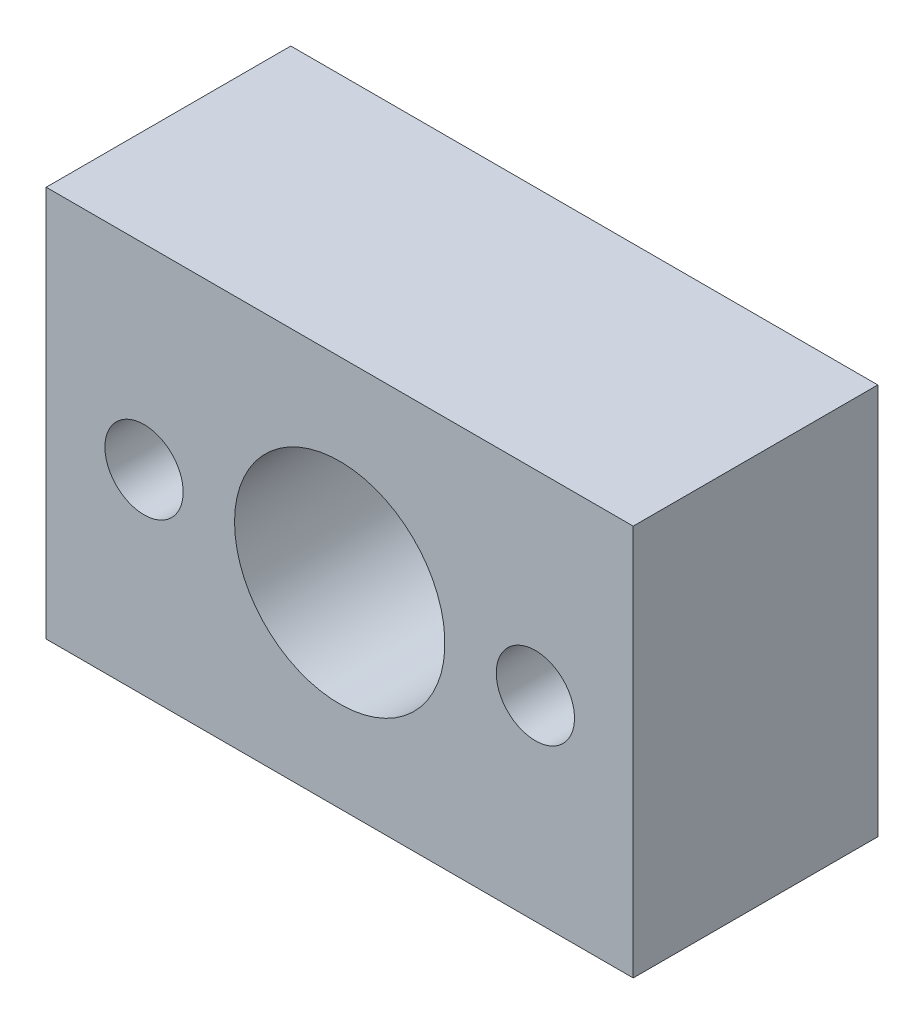
from build123d import *

# Parameters (mm, degrees)
SKETCH1_W           = 24
SKETCH1_H           = 16
BOSS_EXTRUDE1_DEPTH = 10
SKETCH2_R           = 4.3
SKETCH2_R_2         = 1.6
CUT_EXTRUDE2_DEPTH  = 11


with BuildPart() as part:
    # Sketch1 → Boss-Extrude1 (new body)
    with BuildSketch(Plane.XY):
        Rectangle(SKETCH1_W, SKETCH1_H)
    extrude(amount=BOSS_EXTRUDE1_DEPTH)

    # Sketch2 → Cut-Extrude2 (cut)
    with BuildSketch(Plane.XY):
        with Locations(Location((0, 0, 0), (0, 0, 180))):
            Circle(SKETCH2_R)
        with Locations(Location((8, 0, 0), (0, 0, 180))):
            Circle(SKETCH2_R_2)
        with Locations(Location((-8, 0, 0), (0, 0, 180))):
            Circle(SKETCH2_R_2)
    extrude(amount=CUT_EXTRUDE2_DEPTH, mode=Mode.SUBTRACT)


solid = part.part
